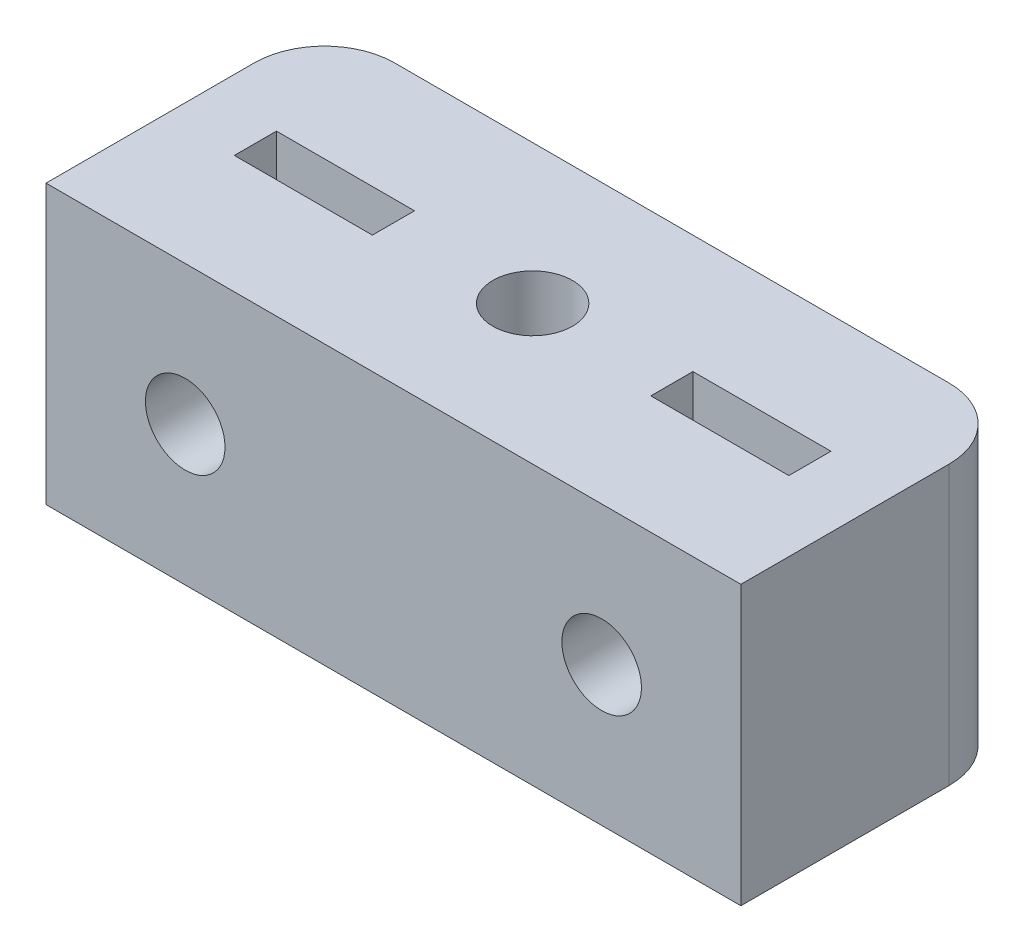
from build123d import *

# Parameters (mm, degrees)
SKETCH1_W           = 29.7
SKETCH1_H           = 11.9
BOSS_EXTRUDE1_DEPTH = 5.95
SKETCH2_R           = 1.7
CUT_EXTRUDE1_DEPTH  = 20.938279765
CUT_EXTRUDE2_DEPTH  = 0.9
SKETCH4_R           = 1.7
CUT_EXTRUDE3_DEPTH  = 20.938279765
CUT_EXTRUDE4_DEPTH  = 0.9
FILLET1_R           = 3


with BuildPart() as part:
    # Sketch1 → Boss-Extrude1 (new, symmetric)
    with BuildSketch(Plane(origin=(0, 0, 0), x_dir=(1, 0, 0), z_dir=(0, 1, 0))):
        Rectangle(SKETCH1_W, SKETCH1_H)
    extrude(amount=BOSS_EXTRUDE1_DEPTH, both=True)

    # Sketch2 → Cut-Extrude1 (cut, through all)
    with BuildSketch(Plane.XY.offset(5.95)):
        with Locations((-8.9, 0)):
            Circle(SKETCH2_R)
    cut_extrude1 = extrude(amount=-CUT_EXTRUDE1_DEPTH, mode=Mode.SUBTRACT)

    # Sketch3 → Cut-Extrude2 (cut, symmetric)
    with BuildSketch(Plane.XY):
        Polygon((-11.85, 2.95), (-11.85, 5.95), (-5.95, 5.95), (-5.95, 2.95), (-5.95, -2.95), (-11.85, -2.95), align=None)
    cut_extrude2 = extrude(amount=CUT_EXTRUDE2_DEPTH, both=True, mode=Mode.SUBTRACT)

    # Mirror1: Cut-Extrude1, Cut-Extrude2 across plane
    add(cut_extrude1.mirror(Plane(origin=(0, 0, 0), x_dir=(0, 0, 1), z_dir=(1, 0, 0))), mode=Mode.SUBTRACT)
    add(cut_extrude2.mirror(Plane(origin=(0, 0, 0), x_dir=(0, 0, 1), z_dir=(1, 0, 0))), mode=Mode.SUBTRACT)

    # Sketch4 → Cut-Extrude3 (cut, through all)
    with BuildSketch(Plane(origin=(0, 5.95, 0), x_dir=(1, 0, 0), z_dir=(0, 1, 0))):
        with Locations(Location((0, 0, 0), (0, 0, 270))):
            Circle(SKETCH4_R)
    extrude(amount=-CUT_EXTRUDE3_DEPTH, mode=Mode.SUBTRACT)

    # Sketch5 → Cut-Extrude4 (cut, symmetric)
    with BuildSketch(Plane(origin=(0, 0, 0), x_dir=(1, 0, 0), z_dir=(0, 1, 0))):
        Polygon((-2.95, 2.95), (-2.95, 5.95), (2.95, 5.95), (2.95, 2.95), (2.95, -2.95), (-2.95, -2.95), align=None)
    extrude(amount=CUT_EXTRUDE4_DEPTH, both=True, mode=Mode.SUBTRACT)

    # Fillet1
    fillet1_edges = [part.edges().sort_by_distance(p)[0] for p in [
        (-14.85, 0, -5.95),
        (14.85, 0, -5.95),
    ]]
    fillet(fillet1_edges, radius=FILLET1_R)


solid = part.part
